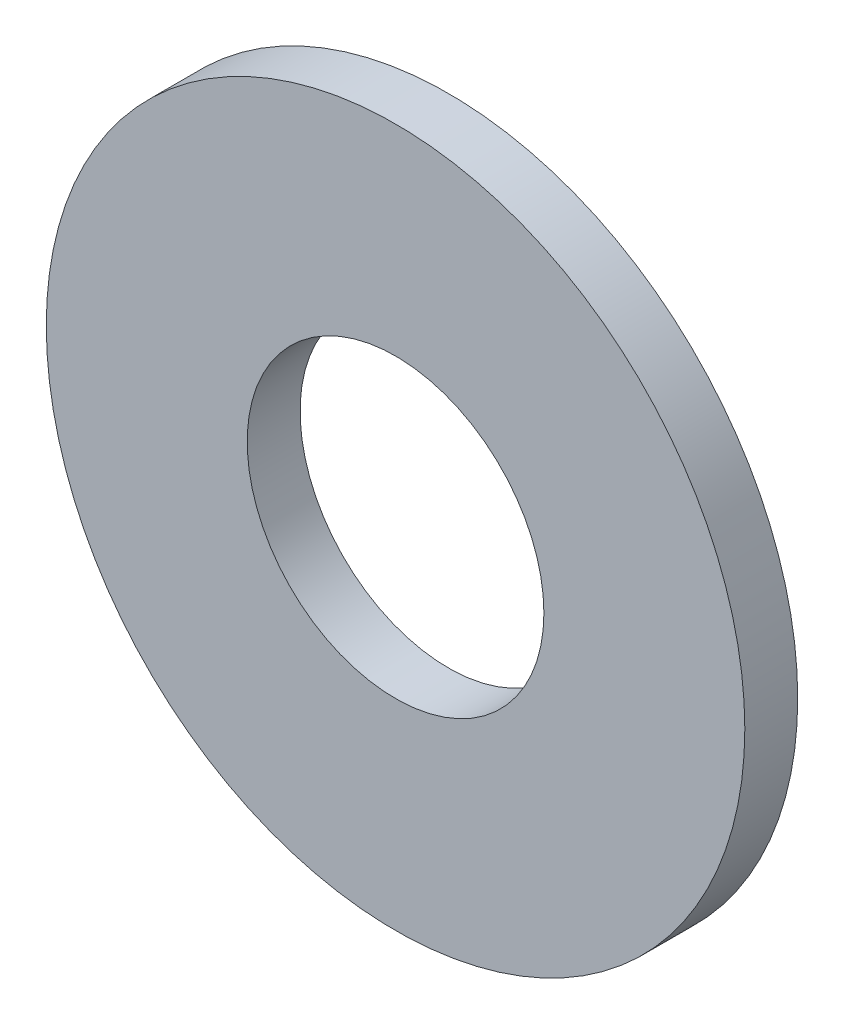
from build123d import *

# Parameters (mm, degrees)
SKETCH1_R                      = 13.081
BASE_DEPTH                     = 1.9812
F_7_16_0_4375_DIAMETER_HOLE1_D = 11.1125


with BuildPart() as part:
    # Sketch1 → BASE (new body)
    with BuildSketch(Plane.XY):
        Circle(SKETCH1_R)
    extrude(amount=BASE_DEPTH)

    # 7/16 (0.4375) Diameter Hole1 (through all)
    with Locations(Plane.XY.offset(1.9812)):
        with Locations((0, 0)):
            Hole(F_7_16_0_4375_DIAMETER_HOLE1_D / 2)


solid = part.part
